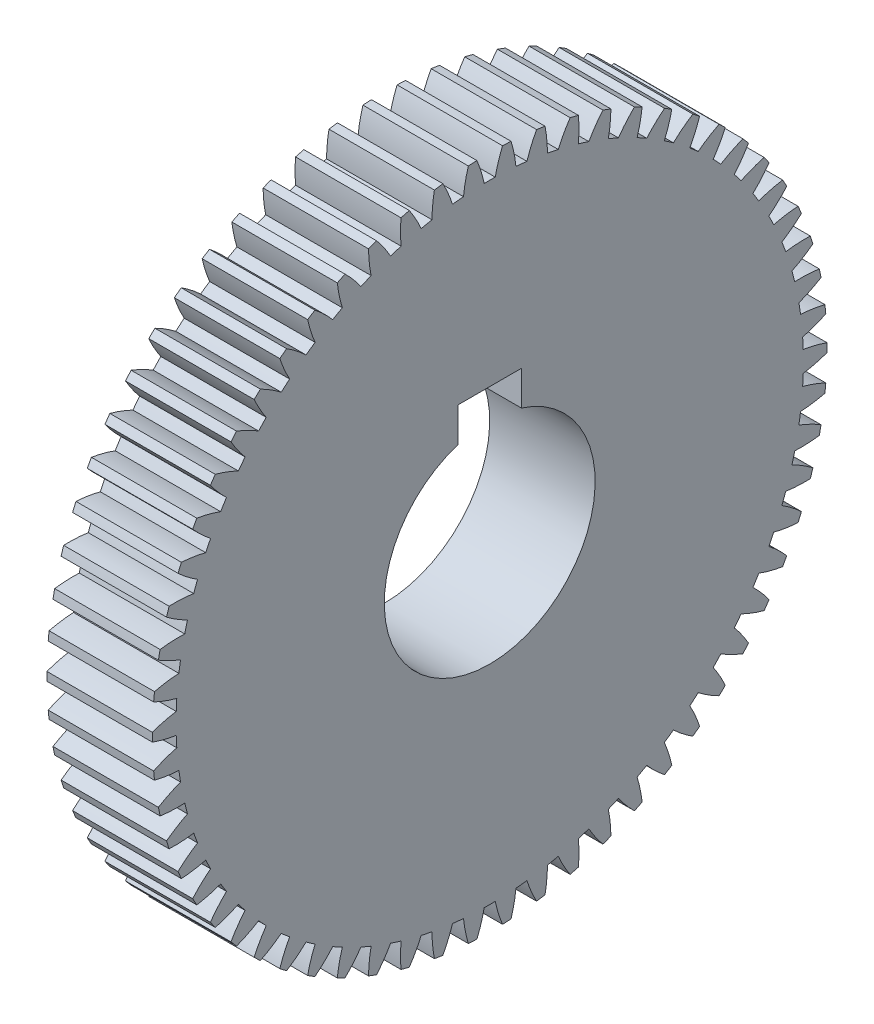
from build123d import *

# Parameters (mm, degrees)
BASPROSKE_W     = 10
BASPROSKE_H     = 32
TOOTHCUT_DEPTH  = 47.346520905
TEETHCUTS_COUNT = 62
TEETHCUTS_ANGLE = 354.193548387
BORSKE_R        = 10
BORE_DEPTH      = 50.0000508
KEYSKE_W        = 6
KEYSKE_H        = 12.8
KEYWAY_DEPTH    = 50.0000508


with BuildPart() as part:
    # BasProSke → Base-Revolve (revolve)
    with BuildSketch(Plane(origin=(0, 0, 0), x_dir=(1, 0, 0), z_dir=(0, 1, 0)), mode=Mode.PRIVATE) as base_revolve_sk:
        with Locations((5, 16)):
            Rectangle(BASPROSKE_W, BASPROSKE_H)
    revolve(base_revolve_sk.sketch.rotate(Axis((-10, 0, 0), (1, 0, 0)), 180), axis=Axis((-10, 0, 0), (1, 0, 0)))

    # TooCutSke → ToothCut (cut, through all)
    with BuildSketch(Plane(origin=(0, 0, 0), x_dir=(0, 0, -1), z_dir=(1, 0, 0))):
        with BuildLine():
            ThreePointArc((0.523996186, 29.744384831), (0, 29.749), (-0.523996186, 29.744384831))
            ThreePointArc((-0.523996186, 29.744384831), (-0.820795245, 30.889919533), (-1.225439169, 32.001945941))
            ThreePointArc((-1.225439169, 32.001945941), (0, 32.0254), (1.225439169, 32.001945941))
            ThreePointArc((1.225439169, 32.001945941), (0.820795245, 30.889919533), (0.523996186, 29.744384831))
        make_face()
    toothcut = extrude(amount=TOOTHCUT_DEPTH, mode=Mode.SUBTRACT)

    # TeethCuts: ToothCut ×62 about axis
    teethcuts_axis = Axis((-10, 0, 0), (1, 0, 0))
    for i in range(1, TEETHCUTS_COUNT):
        add(toothcut.rotate(teethcuts_axis, i * TEETHCUTS_ANGLE / (TEETHCUTS_COUNT - 1)), mode=Mode.SUBTRACT)

    # BorSke → Bore (cut, symmetric)
    with BuildSketch(Plane(origin=(0, 0, 0), x_dir=(0, 0, -1), z_dir=(1, 0, 0))):
        with Locations(Location((0, 0, 0), (0, 0, 180))):
            Circle(BORSKE_R)
    extrude(amount=BORE_DEPTH, both=True, mode=Mode.SUBTRACT)

    # KeySke → Keyway (cut, symmetric)
    with BuildSketch(Plane(origin=(0, 0, 0), x_dir=(0, 0, -1), z_dir=(1, 0, 0))):
        with Locations((0, 6.4)):
            Rectangle(KEYSKE_W, KEYSKE_H)
    extrude(amount=KEYWAY_DEPTH, both=True, mode=Mode.SUBTRACT)


solid = part.part
